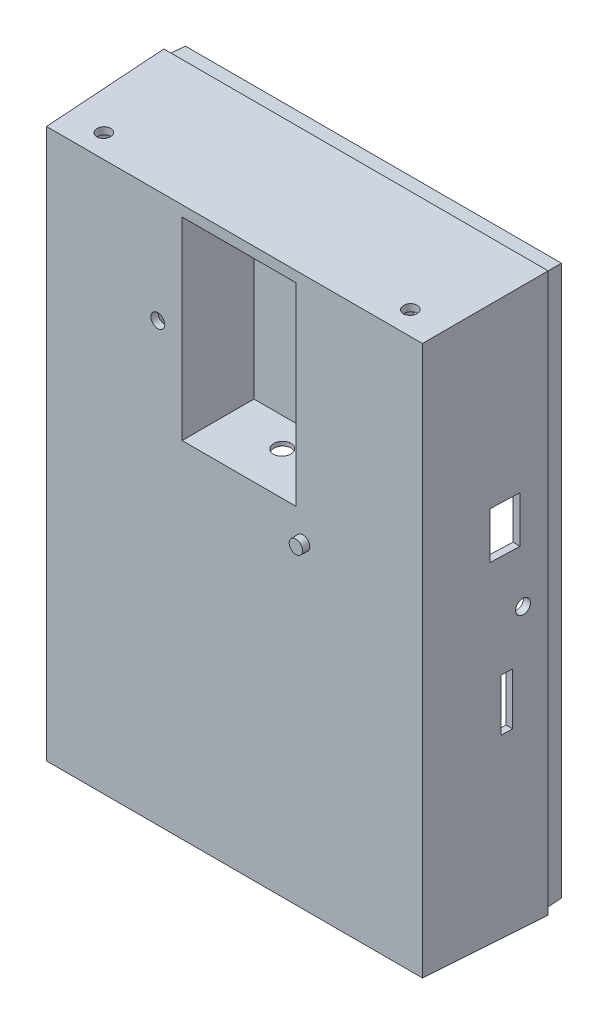
from build123d import *

# Parameters (mm, degrees)
SKETCH1_W                     = 110.69841539
SKETCH1_H                     = 160.69841539
BOSS_EXTRUDE1_DEPTH           = 35
BOSS_EXTRUDE1_TAPER           = 2
SHELL1_T                      = -2
SKETCH9_W                     = 35
SKETCH9_H                     = 58
BOSS_EXTRUDE5_DEPTH           = 32
BOSS_EXTRUDE5_TAPER           = 2
SKETCH6_W                     = 3.2
SKETCH6_H                     = 15
CUT_EXTRUDE3_DEPTH            = 2
CUT_EXTRUDE3_DRAFT            = 2
SKETCH11_W                    = 32.765070753
SKETCH11_H                    = 55.765070753
CUT_EXTRUDE4_DEPTH            = 20
CUT_EXTRUDE4_DRAFT            = -2
SKETCH13_R                    = 2.5
CUT_EXTRUDE5_DEPTH            = 1.186583
CUT_EXTRUDE5_DRAFT            = 2
SKETCH14_R                    = 4
BOSS_EXTRUDE6_DEPTH           = 18
BOSS_EXTRUDE6_DRAFT           = 2
BOSS_EXTRUDE6_PROFILE_2_DEPTH = 18
BOSS_EXTRUDE6_PROFILE_2_DRAFT = 2
BOSS_EXTRUDE6_PROFILE_3_DEPTH = 18
BOSS_EXTRUDE6_PROFILE_3_DRAFT = 2
BOSS_EXTRUDE6_PROFILE_4_DEPTH = 18
BOSS_EXTRUDE6_PROFILE_4_DRAFT = 2
SKETCH15_R                    = 2
CUT_EXTRUDE6_DEPTH            = 5
CUT_EXTRUDE6_DRAFT            = -2
CUT_EXTRUDE6_PROFILE_2_DEPTH  = 5
CUT_EXTRUDE6_PROFILE_2_DRAFT  = -2
CUT_EXTRUDE6_PROFILE_3_DEPTH  = 5
CUT_EXTRUDE6_PROFILE_3_DRAFT  = -2
CUT_EXTRUDE6_PROFILE_4_DEPTH  = 5
CUT_EXTRUDE6_PROFILE_4_DRAFT  = -2
SKETCH17_W                    = 108.695977213
SKETCH17_H                    = 158.695977213
SKETCH17_W_2                  = 106.695977213
SKETCH17_H_2                  = 156.695977213
BOSS_EXTRUDE8_DEPTH           = 5
BOSS_EXTRUDE8_DRAFT           = 2
SKETCH18_R                    = 2
BOSS_EXTRUDE9_DEPTH           = 2
BOSS_EXTRUDE9_TAPER           = 2
SKETCH19_R                    = 2
CUT_EXTRUDE7_DEPTH            = 2
CUT_EXTRUDE7_DRAFT            = -2
SKETCH26_R                    = 2
CUT_EXTRUDE11_DEPTH           = 2
CUT_EXTRUDE11_DRAFT           = 2
SKETCH27_R                    = 2
CUT_EXTRUDE12_DEPTH           = 2
CUT_EXTRUDE12_DRAFT           = 2
SKETCH29_R                    = 6
CUT_EXTRUDE15_DEPTH           = 10
CUT_EXTRUDE15_DRAFT           = 2
SKETCH32_W                    = 8.3
SKETCH32_H                    = 13.4
CUT_EXTRUDE16_DEPTH           = 2
CUT_EXTRUDE16_DRAFT           = -2
SKETCH34_R                    = 2
CUT_EXTRUDE17_DEPTH           = 2
CUT_EXTRUDE17_DRAFT           = -2
CUT_EXTRUDE17_PROFILE_2_DEPTH = 2
CUT_EXTRUDE17_PROFILE_2_DRAFT = -2


with BuildPart() as part:
    # Sketch1 → Boss-Extrude1 (new body)
    with BuildSketch(Plane(origin=(-178.93563268, -87.827617858, -1672.876510568), x_dir=(1, 0, 0), z_dir=(0, 0, 1))):
        with Locations((82.659063847, 86.357614413)):
            Rectangle(SKETCH1_W, SKETCH1_H)
    extrude(amount=BOSS_EXTRUDE1_DEPTH, taper=BOSS_EXTRUDE1_TAPER)

    # Shell1
    shell1_openings = [part.faces().sort_by_distance(p)[0] for p in [
        (-96.276568833, -1.470003445, -1672.876510568),
    ]]
    offset(amount=SHELL1_T, openings=shell1_openings, kind=Kind.INTERSECTION)

    # Sketch9 → Boss-Extrude5 (add)
    with BuildSketch(Plane(origin=(0, 0, -1639.876510568), x_dir=(-1, 0, 0), z_dir=(0, 0, -1))):
        with Locations((94.972172046, 46.725599768)):
            Rectangle(SKETCH9_W, SKETCH9_H)
    extrude(amount=BOSS_EXTRUDE5_DEPTH, taper=BOSS_EXTRUDE5_TAPER)


with BuildPart() as cut_extrude3_tool:
    # Sketch6 → Cut-Extrude3 (with draft: the straight prism first)
    with BuildSketch(Plane(origin=(-99.224495834, 0, -3.464995747), x_dir=(0.03489949670250102, 0, -0.9993908270190958), z_dir=(0.9993908270190958, 0, 0.03489949670250102))):
        with Locations((1658.917761042, -23.096984207)):
            Rectangle(SKETCH6_W, SKETCH6_H)
    extrude(amount=-CUT_EXTRUDE3_DEPTH)
    # Cut-Extrude3: the draft: its side faces are tilted about the plane it starts from
    cut_extrude3_sides = [cut_extrude3_tool.faces().sort_by_distance(p)[0] for p in [
        (-42.328491729, -30.596984207, -1661.407088408),
        (-42.272652535, -23.096984207, -1663.006113731),
        (-42.328491729, -15.596984207, -1661.407088408),
        (-42.384330924, -23.096984207, -1659.808063085),
    ]]
    draft(cut_extrude3_sides, Plane(origin=(-99.224495834, 0, -3.464995747), x_dir=(0.03489949670250102, 0, -0.9993908270190958), z_dir=(0.9993908270190958, 0, 0.03489949670250102)), CUT_EXTRUDE3_DRAFT)


with BuildPart() as part_1:
    add(part.part)

    # Cut-Extrude3: cut by cut_extrude3_tool
    add(cut_extrude3_tool.part, mode=Mode.SUBTRACT)


with BuildPart() as cut_extrude4_tool:
    # Sketch11 → Cut-Extrude4 (with draft: the straight prism first)
    with BuildSketch(Plane.XY.offset(-1637.876510568)):
        with Locations((-94.972172046, 46.725599769)):
            Rectangle(SKETCH11_W, SKETCH11_H)
    extrude(amount=-CUT_EXTRUDE4_DEPTH)
    # Cut-Extrude4: the draft: its side faces are tilted about the plane it starts from
    cut_extrude4_sides = [cut_extrude4_tool.faces().sort_by_distance(p)[0] for p in [
        (-111.354707422, 46.725599768, -1647.876510568),
        (-94.972172046, 18.843064392, -1647.876510568),
        (-78.589636669, 46.725599768, -1647.876510568),
        (-94.972172046, 74.608135145, -1647.876510568),
    ]]
    draft(cut_extrude4_sides, Plane.XY.offset(-1637.876510568), CUT_EXTRUDE4_DRAFT)


with BuildPart() as part_2:
    add(part_1.part)

    # Cut-Extrude4: cut by cut_extrude4_tool
    add(cut_extrude4_tool.part, mode=Mode.SUBTRACT)


with BuildPart() as cut_extrude5_tool:
    # Sketch13 → Cut-Extrude5 (with draft: the straight prism first)
    with BuildSketch(Plane(origin=(0, -39.491990943, -1.379090712), x_dir=(1, 0, 0), z_dir=(0, -0.9993908270190958, -0.03489949670250101))):
        with Locations((-94.472172046, -1649.496156617)):
            Circle(SKETCH13_R)
    extrude(amount=-CUT_EXTRUDE5_DEPTH)
    # Cut-Extrude5: the draft: its side faces are tilted about the plane it starts from
    cut_extrude5_sides = [cut_extrude5_tool.faces().sort_by_distance(p)[0] for p in [
        (-96.972172046, 18.667524818, -1649.849713264),
    ]]
    draft(cut_extrude5_sides, Plane(origin=(0, -39.491990943, -1.379090712), x_dir=(1, 0, 0), z_dir=(0, -0.9993908270190958, -0.03489949670250101)), CUT_EXTRUDE5_DRAFT)


with BuildPart() as part_3:
    add(part_2.part)

    # Cut-Extrude5: cut by cut_extrude5_tool
    add(cut_extrude5_tool.part, mode=Mode.SUBTRACT)


with BuildPart() as boss_extrude6_tool:
    # Sketch14 → Boss-Extrude6 (with draft: the straight prism first)
    with BuildSketch(Plane(origin=(0, 0, -1639.876510568), x_dir=(-1, 0, 0), z_dir=(0, 0, -1))):
        with Locations((59.079257377, -3.665606658)):
            Circle(SKETCH14_R)
    extrude(amount=BOSS_EXTRUDE6_DEPTH)
    # Boss-Extrude6: the draft: its side faces are tilted about the plane it starts from
    boss_extrude6_sides = [boss_extrude6_tool.faces().sort_by_distance(p)[0] for p in [
        (-55.079257377, -3.665606658, -1648.876510568),
    ]]
    draft(boss_extrude6_sides, Plane(origin=(0, 0, -1639.876510568), x_dir=(-1, 0, 0), z_dir=(0, 0, -1)), BOSS_EXTRUDE6_DRAFT)


with BuildPart() as part_4:
    add(part_3.part)

    # Boss-Extrude6: add boss_extrude6_tool
    add(boss_extrude6_tool.part)


with BuildPart() as boss_extrude6_profile_2_tool:
    # Sketch14 → Boss-Extrude6 profile 2 (with draft: the straight prism first)
    with BuildSketch(Plane(origin=(0, 0, -1639.876510568), x_dir=(-1, 0, 0), z_dir=(0, 0, -1))):
        with Locations((59.079257377, -43.665606658)):
            Circle(SKETCH14_R)
    extrude(amount=BOSS_EXTRUDE6_PROFILE_2_DEPTH)
    # Boss-Extrude6 profile 2: the draft: its side faces are tilted about the plane it starts from
    boss_extrude6_profile_2_sides = [boss_extrude6_profile_2_tool.faces().sort_by_distance(p)[0] for p in [
        (-55.079257377, -43.665606658, -1648.876510568),
    ]]
    draft(boss_extrude6_profile_2_sides, Plane(origin=(0, 0, -1639.876510568), x_dir=(-1, 0, 0), z_dir=(0, 0, -1)), BOSS_EXTRUDE6_PROFILE_2_DRAFT)


with BuildPart() as part_5:
    add(part_4.part)

    # Boss-Extrude6 profile 2: add boss_extrude6_profile_2_tool
    add(boss_extrude6_profile_2_tool.part)


with BuildPart() as boss_extrude6_profile_3_tool:
    # Sketch14 → Boss-Extrude6 profile 3 (with draft: the straight prism first)
    with BuildSketch(Plane(origin=(0, 0, -1639.876510568), x_dir=(-1, 0, 0), z_dir=(0, 0, -1))):
        with Locations((119.079257377, -3.665606658)):
            Circle(SKETCH14_R)
    extrude(amount=BOSS_EXTRUDE6_PROFILE_3_DEPTH)
    # Boss-Extrude6 profile 3: the draft: its side faces are tilted about the plane it starts from
    boss_extrude6_profile_3_sides = [boss_extrude6_profile_3_tool.faces().sort_by_distance(p)[0] for p in [
        (-115.079257377, -3.665606658, -1648.876510568),
    ]]
    draft(boss_extrude6_profile_3_sides, Plane(origin=(0, 0, -1639.876510568), x_dir=(-1, 0, 0), z_dir=(0, 0, -1)), BOSS_EXTRUDE6_PROFILE_3_DRAFT)


with BuildPart() as part_6:
    add(part_5.part)

    # Boss-Extrude6 profile 3: add boss_extrude6_profile_3_tool
    add(boss_extrude6_profile_3_tool.part)


with BuildPart() as boss_extrude6_profile_4_tool:
    # Sketch14 → Boss-Extrude6 profile 4 (with draft: the straight prism first)
    with BuildSketch(Plane(origin=(0, 0, -1639.876510568), x_dir=(-1, 0, 0), z_dir=(0, 0, -1))):
        with Locations((119.079257377, -43.665606658)):
            Circle(SKETCH14_R)
    extrude(amount=BOSS_EXTRUDE6_PROFILE_4_DEPTH)
    # Boss-Extrude6 profile 4: the draft: its side faces are tilted about the plane it starts from
    boss_extrude6_profile_4_sides = [boss_extrude6_profile_4_tool.faces().sort_by_distance(p)[0] for p in [
        (-115.079257377, -43.665606658, -1648.876510568),
    ]]
    draft(boss_extrude6_profile_4_sides, Plane(origin=(0, 0, -1639.876510568), x_dir=(-1, 0, 0), z_dir=(0, 0, -1)), BOSS_EXTRUDE6_PROFILE_4_DRAFT)


with BuildPart() as part_7:
    add(part_6.part)

    # Boss-Extrude6 profile 4: add boss_extrude6_profile_4_tool
    add(boss_extrude6_profile_4_tool.part)


with BuildPart() as cut_extrude6_tool:
    # Sketch15 → Cut-Extrude6 (with draft: the straight prism first)
    with BuildSketch(Plane(origin=(0, 0, -1657.876510568), x_dir=(-1, 0, 0), z_dir=(0, 0, -1))):
        with Locations((59.079257377, -3.665606658)):
            Circle(SKETCH15_R)
    extrude(amount=-CUT_EXTRUDE6_DEPTH)
    # Cut-Extrude6: the draft: its side faces are tilted about the plane it starts from
    cut_extrude6_sides = [cut_extrude6_tool.faces().sort_by_distance(p)[0] for p in [
        (-57.079257377, -3.665606658, -1655.376510568),
    ]]
    draft(cut_extrude6_sides, Plane(origin=(0, 0, -1657.876510568), x_dir=(-1, 0, 0), z_dir=(0, 0, -1)), CUT_EXTRUDE6_DRAFT)


with BuildPart() as part_8:
    add(part_7.part)

    # Cut-Extrude6: cut by cut_extrude6_tool
    add(cut_extrude6_tool.part, mode=Mode.SUBTRACT)


with BuildPart() as cut_extrude6_profile_2_tool:
    # Sketch15 → Cut-Extrude6 profile 2 (with draft: the straight prism first)
    with BuildSketch(Plane(origin=(0, 0, -1657.876510568), x_dir=(-1, 0, 0), z_dir=(0, 0, -1))):
        with Locations((119.079257377, -3.665606658)):
            Circle(SKETCH15_R)
    extrude(amount=-CUT_EXTRUDE6_PROFILE_2_DEPTH)
    # Cut-Extrude6 profile 2: the draft: its side faces are tilted about the plane it starts from
    cut_extrude6_profile_2_sides = [cut_extrude6_profile_2_tool.faces().sort_by_distance(p)[0] for p in [
        (-117.079257377, -3.665606658, -1655.376510568),
    ]]
    draft(cut_extrude6_profile_2_sides, Plane(origin=(0, 0, -1657.876510568), x_dir=(-1, 0, 0), z_dir=(0, 0, -1)), CUT_EXTRUDE6_PROFILE_2_DRAFT)


with BuildPart() as part_9:
    add(part_8.part)

    # Cut-Extrude6 profile 2: cut by cut_extrude6_profile_2_tool
    add(cut_extrude6_profile_2_tool.part, mode=Mode.SUBTRACT)


with BuildPart() as cut_extrude6_profile_3_tool:
    # Sketch15 → Cut-Extrude6 profile 3 (with draft: the straight prism first)
    with BuildSketch(Plane(origin=(0, 0, -1657.876510568), x_dir=(-1, 0, 0), z_dir=(0, 0, -1))):
        with Locations((119.079257377, -43.665606658)):
            Circle(SKETCH15_R)
    extrude(amount=-CUT_EXTRUDE6_PROFILE_3_DEPTH)
    # Cut-Extrude6 profile 3: the draft: its side faces are tilted about the plane it starts from
    cut_extrude6_profile_3_sides = [cut_extrude6_profile_3_tool.faces().sort_by_distance(p)[0] for p in [
        (-117.079257377, -43.665606658, -1655.376510568),
    ]]
    draft(cut_extrude6_profile_3_sides, Plane(origin=(0, 0, -1657.876510568), x_dir=(-1, 0, 0), z_dir=(0, 0, -1)), CUT_EXTRUDE6_PROFILE_3_DRAFT)


with BuildPart() as part_10:
    add(part_9.part)

    # Cut-Extrude6 profile 3: cut by cut_extrude6_profile_3_tool
    add(cut_extrude6_profile_3_tool.part, mode=Mode.SUBTRACT)


with BuildPart() as cut_extrude6_profile_4_tool:
    # Sketch15 → Cut-Extrude6 profile 4 (with draft: the straight prism first)
    with BuildSketch(Plane(origin=(0, 0, -1657.876510568), x_dir=(-1, 0, 0), z_dir=(0, 0, -1))):
        with Locations((59.079257377, -43.665606658)):
            Circle(SKETCH15_R)
    extrude(amount=-CUT_EXTRUDE6_PROFILE_4_DEPTH)
    # Cut-Extrude6 profile 4: the draft: its side faces are tilted about the plane it starts from
    cut_extrude6_profile_4_sides = [cut_extrude6_profile_4_tool.faces().sort_by_distance(p)[0] for p in [
        (-57.079257377, -43.665606658, -1655.376510568),
    ]]
    draft(cut_extrude6_profile_4_sides, Plane(origin=(0, 0, -1657.876510568), x_dir=(-1, 0, 0), z_dir=(0, 0, -1)), CUT_EXTRUDE6_PROFILE_4_DRAFT)


with BuildPart() as part_11:
    add(part_10.part)

    # Cut-Extrude6 profile 4: cut by cut_extrude6_profile_4_tool
    add(cut_extrude6_profile_4_tool.part, mode=Mode.SUBTRACT)


with BuildPart() as boss_extrude8_tool:
    # Sketch17 → Boss-Extrude8 (with draft: the straight prism first)
    with BuildSketch(Plane(origin=(0, 0, -1672.876510568), x_dir=(-1, 0, 0), z_dir=(0, 0, -1))):
        with Locations((96.276568833, -1.470003445)):
            Rectangle(SKETCH17_W, SKETCH17_H)
        with Locations((96.276568833, -1.470003445)):
            Rectangle(SKETCH17_W_2, SKETCH17_H_2, mode=Mode.SUBTRACT)
    extrude(amount=BOSS_EXTRUDE8_DEPTH)
    # Boss-Extrude8: the draft: its side faces are tilted about the plane it starts from
    boss_extrude8_sides = [boss_extrude8_tool.faces().sort_by_distance(p)[0] for p in [
        (-41.928580226, -1.470003445, -1675.376510568),
        (-96.276568833, -80.817992051, -1675.376510568),
        (-150.624557439, -1.470003445, -1675.376510568),
        (-96.276568833, 77.877985162, -1675.376510568),
        (-96.276568833, -79.817992051, -1675.376510568),
        (-42.928580226, -1.470003445, -1675.376510568),
        (-96.276568833, 76.877985162, -1675.376510568),
        (-149.624557439, -1.470003445, -1675.376510568),
    ]]
    draft(boss_extrude8_sides, Plane(origin=(0, 0, -1672.876510568), x_dir=(-1, 0, 0), z_dir=(0, 0, -1)), BOSS_EXTRUDE8_DRAFT)


with BuildPart() as part_12:
    add(part_11.part)

    # Boss-Extrude8: add boss_extrude8_tool
    add(boss_extrude8_tool.part)

    # Sketch18 → Boss-Extrude9 (add)
    with BuildSketch(Plane.XY.offset(-1637.876510568)):
        with Locations((-76.589636669, 10.725599768)):
            Circle(SKETCH18_R)
    extrude(amount=BOSS_EXTRUDE9_DEPTH, taper=BOSS_EXTRUDE9_TAPER)


with BuildPart() as cut_extrude7_tool:
    # Sketch19 → Cut-Extrude7 (with draft: the straight prism first)
    with BuildSketch(Plane.XY.offset(-1637.876510568)):
        with Locations((-118.354707422, 45.243064392)):
            Circle(SKETCH19_R)
    extrude(amount=-CUT_EXTRUDE7_DEPTH)
    # Cut-Extrude7: the draft: its side faces are tilted about the plane it starts from
    cut_extrude7_sides = [cut_extrude7_tool.faces().sort_by_distance(p)[0] for p in [
        (-120.354707422, 45.243064392, -1638.876510568),
    ]]
    draft(cut_extrude7_sides, Plane.XY.offset(-1637.876510568), CUT_EXTRUDE7_DRAFT)


with BuildPart() as part_13:
    add(part_12.part)

    # Cut-Extrude7: cut by cut_extrude7_tool
    add(cut_extrude7_tool.part, mode=Mode.SUBTRACT)


with BuildPart() as cut_extrude11_tool:
    # Sketch26 → Cut-Extrude11 (with draft: the straight prism first)
    with BuildSketch(Plane(origin=(-91.095335295, 0, 3.181119206), x_dir=(-0.03489949670250101, 0, -0.9993908270190958), z_dir=(0.9993908270190958, 0, -0.03489949670250101))):
        with Locations((1670.149102685, -1.470003445)):
            Circle(SKETCH26_R)
    extrude(amount=-CUT_EXTRUDE11_DEPTH)
    # Cut-Extrude11: the draft: its side faces are tilted about the plane it starts from
    cut_extrude11_sides = [cut_extrude11_tool.faces().sort_by_distance(p)[0] for p in [
        (-150.31229023, -1.470003445, -1663.916892622),
    ]]
    draft(cut_extrude11_sides, Plane(origin=(-91.095335295, 0, 3.181119206), x_dir=(-0.03489949670250101, 0, -0.9993908270190958), z_dir=(0.9993908270190958, 0, -0.03489949670250101)), CUT_EXTRUDE11_DRAFT)


with BuildPart() as part_14:
    add(part_13.part)

    # Cut-Extrude11: cut by cut_extrude11_tool
    add(cut_extrude11_tool.part, mode=Mode.SUBTRACT)


with BuildPart() as cut_extrude12_tool:
    # Sketch27 → Cut-Extrude12 (with draft: the straight prism first)
    with BuildSketch(Plane(origin=(-101.223277488, 0, -3.53479474), x_dir=(-0.03489949670250102, 0, 0.9993908270190958), z_dir=(-0.9993908270190958, 0, -0.03489949670250102))):
        with Locations((-1663.429095092, -1.470003445)):
            Circle(SKETCH27_R)
    extrude(amount=-CUT_EXTRUDE12_DEPTH)
    # Cut-Extrude12: the draft: its side faces are tilted about the plane it starts from
    cut_extrude12_sides = [cut_extrude12_tool.faces().sort_by_distance(p)[0] for p in [
        (-42.101249448, -1.470003445, -1667.91445593),
    ]]
    draft(cut_extrude12_sides, Plane(origin=(-101.223277488, 0, -3.53479474), x_dir=(-0.03489949670250102, 0, 0.9993908270190958), z_dir=(-0.9993908270190958, 0, -0.03489949670250102)), CUT_EXTRUDE12_DRAFT)


with BuildPart() as part_15:
    add(part_14.part)

    # Cut-Extrude12: cut by cut_extrude12_tool
    add(cut_extrude12_tool.part, mode=Mode.SUBTRACT)


with BuildPart() as cut_extrude15_tool:
    # Sketch29 → Cut-Extrude15 (with draft: the straight prism first)
    with BuildSketch(Plane(origin=(-93.094116949, 0, 3.250918199), x_dir=(0.03489949670250101, 0, 0.9993908270190958), z_dir=(-0.9993908270190958, 0, 0.03489949670250101))):
        with Locations((-1662.149102685, -30.596984207)):
            Circle(SKETCH29_R)
    extrude(amount=-CUT_EXTRUDE15_DEPTH)
    # Cut-Extrude15: the draft: its side faces are tilted about the plane it starts from
    cut_extrude15_sides = [cut_extrude15_tool.faces().sort_by_distance(p)[0] for p in [
        (-146.314726922, -30.596984207, -1664.056490608),
    ]]
    draft(cut_extrude15_sides, Plane(origin=(-93.094116949, 0, 3.250918199), x_dir=(0.03489949670250101, 0, 0.9993908270190958), z_dir=(-0.9993908270190958, 0, 0.03489949670250101)), CUT_EXTRUDE15_DRAFT)


with BuildPart() as part_16:
    add(part_15.part)

    # Cut-Extrude15: cut by cut_extrude15_tool
    add(cut_extrude15_tool.part, mode=Mode.SUBTRACT)


with BuildPart() as cut_extrude16_tool:
    # Sketch32 → Cut-Extrude16 (with draft: the straight prism first)
    with BuildSketch(Plane(origin=(-99.224495834, 0, -3.464995747), x_dir=(0.03489949670250102, 0, -0.9993908270190958), z_dir=(0.9993908270190958, 0, 0.03489949670250102))):
        with Locations((1658.429095092, 20.656977318)):
            Rectangle(SKETCH32_W, SKETCH32_H)
    extrude(amount=-CUT_EXTRUDE16_DEPTH)
    # Cut-Extrude16: the draft: its side faces are tilted about the plane it starts from
    cut_extrude16_sides = [cut_extrude16_tool.faces().sort_by_distance(p)[0] for p in [
        (-42.200713014, 20.656977318, -1665.066192073),
        (-42.345545925, 27.356977318, -1660.918720141),
        (-42.490378836, 20.656977318, -1656.771248208),
        (-42.345545925, 13.956977318, -1660.918720141),
    ]]
    draft(cut_extrude16_sides, Plane(origin=(-99.224495834, 0, -3.464995747), x_dir=(0.03489949670250102, 0, -0.9993908270190958), z_dir=(0.9993908270190958, 0, 0.03489949670250102)), CUT_EXTRUDE16_DRAFT)


with BuildPart() as part_17:
    add(part_16.part)

    # Cut-Extrude16: cut by cut_extrude16_tool
    add(cut_extrude16_tool.part, mode=Mode.SUBTRACT)


with BuildPart() as cut_extrude17_tool:
    # Sketch34 → Cut-Extrude17 (with draft: the straight prism first)
    with BuildSketch(Plane(origin=(0, 20.436148168, 0.713646019), x_dir=(1, 0, 0), z_dir=(0, 0.9993908270190958, 0.03489949670250101))):
        with Locations((-140.403549595, 1646.088949876)):
            Circle(SKETCH34_R)
    extrude(amount=-CUT_EXTRUDE17_DEPTH)
    # Cut-Extrude17: the draft: its side faces are tilted about the plane it starts from
    cut_extrude17_sides = [cut_extrude17_tool.faces().sort_by_distance(p)[0] for p in [
        (-142.403549595, 76.88443322, -1644.40745044),
    ]]
    draft(cut_extrude17_sides, Plane(origin=(0, 20.436148168, 0.713646019), x_dir=(1, 0, 0), z_dir=(0, 0.9993908270190958, 0.03489949670250101)), CUT_EXTRUDE17_DRAFT)


with BuildPart() as part_18:
    add(part_17.part)

    # Cut-Extrude17: cut by cut_extrude17_tool
    add(cut_extrude17_tool.part, mode=Mode.SUBTRACT)


with BuildPart() as cut_extrude17_profile_2_tool:
    # Sketch34 → Cut-Extrude17 profile 2 (with draft: the straight prism first)
    with BuildSketch(Plane(origin=(0, 20.436148168, 0.713646019), x_dir=(1, 0, 0), z_dir=(0, 0.9993908270190958, 0.03489949670250101))):
        with Locations((-52.14958807, 1646.088949876)):
            Circle(SKETCH34_R)
    extrude(amount=-CUT_EXTRUDE17_PROFILE_2_DEPTH)
    # Cut-Extrude17 profile 2: the draft: its side faces are tilted about the plane it starts from
    cut_extrude17_profile_2_sides = [cut_extrude17_profile_2_tool.faces().sort_by_distance(p)[0] for p in [
        (-54.14958807, 76.88443322, -1644.40745044),
    ]]
    draft(cut_extrude17_profile_2_sides, Plane(origin=(0, 20.436148168, 0.713646019), x_dir=(1, 0, 0), z_dir=(0, 0.9993908270190958, 0.03489949670250101)), CUT_EXTRUDE17_PROFILE_2_DRAFT)


with BuildPart() as part_19:
    add(part_18.part)

    # Cut-Extrude17 profile 2: cut by cut_extrude17_profile_2_tool
    add(cut_extrude17_profile_2_tool.part, mode=Mode.SUBTRACT)


solid = part_19.part
